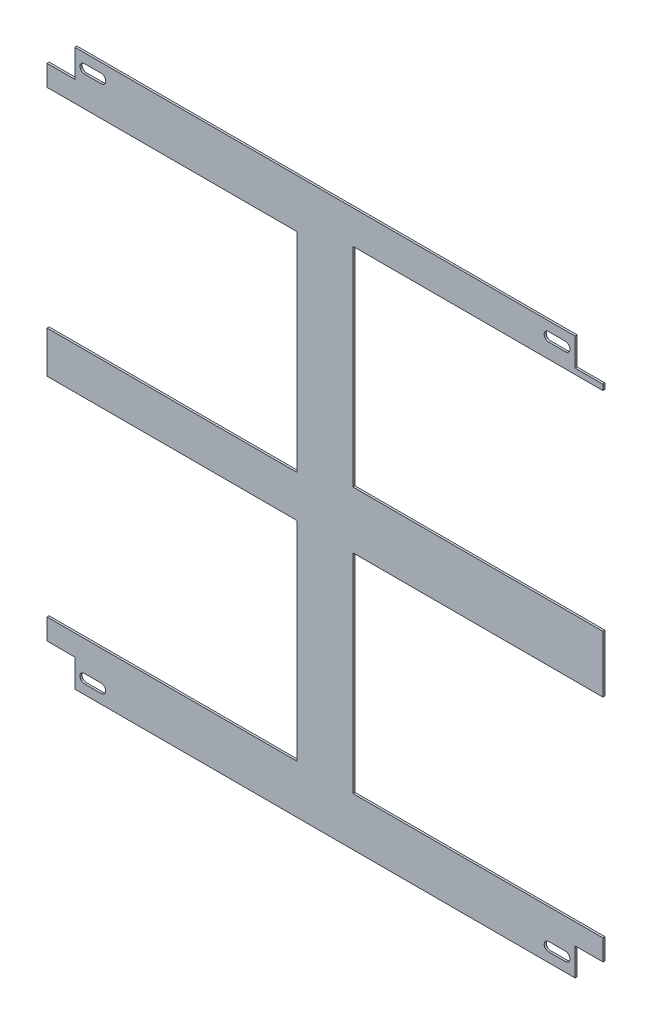
from build123d import *

# Parameters (mm, degrees)
EXTRUDE_1_DEPTH = 1.5


with BuildPart() as part:
    # 草图1 → 凸台-拉伸1 (new body)
    with BuildSketch(Plane.XY):
        Polygon((-10, 366), (-160, 366), (-160, 216), (-10, 216), (20, 216), (20, 175), (-10, 175), (-160, 175), (-160, 25), (-10, 25), (20, 25), (20, 10), (0, 10), (0, -10), (-360, -10), (-360, 10), (-380, 10), (-380, 25), (-350, 25), (-200, 25), (-200, 175), (-350, 175), (-380, 175), (-380, 205), (-350, 205), (-200, 205), (-200, 355), (-350, 355), (-380, 355), (-380, 370), (-360, 370), (-360, 390), (0, 390), (0, 370), (20, 370), (20, 366), align=None)
        with BuildLine():
            Line((-353, -3.25), (-341, -3.25))
            ThreePointArc((-341, -3.25), (-337.75, 0), (-341, 3.25))
            Line((-341, 3.25), (-353, 3.25))
            ThreePointArc((-353, 3.25), (-356.25, 0), (-353, -3.25))
        make_face(mode=Mode.SUBTRACT)
        with BuildLine():
            Line((-19, -3.25), (-7, -3.25))
            ThreePointArc((-7, -3.25), (-3.75, 0), (-7, 3.25))
            Line((-7, 3.25), (-19, 3.25))
            ThreePointArc((-19, 3.25), (-22.25, 0), (-19, -3.25))
        make_face(mode=Mode.SUBTRACT)
        with BuildLine():
            Line((-19, 376.75), (-7, 376.75))
            ThreePointArc((-7, 376.75), (-3.75, 380), (-7, 383.25))
            Line((-7, 383.25), (-19, 383.25))
            ThreePointArc((-19, 383.25), (-22.25, 380), (-19, 376.75))
        make_face(mode=Mode.SUBTRACT)
        with BuildLine():
            Line((-353, 376.75), (-341, 376.75))
            ThreePointArc((-341, 376.75), (-337.75, 380), (-341, 383.25))
            Line((-341, 383.25), (-353, 383.25))
            ThreePointArc((-353, 383.25), (-356.25, 380), (-353, 376.75))
        make_face(mode=Mode.SUBTRACT)
    extrude(amount=EXTRUDE_1_DEPTH)


solid = part.part
